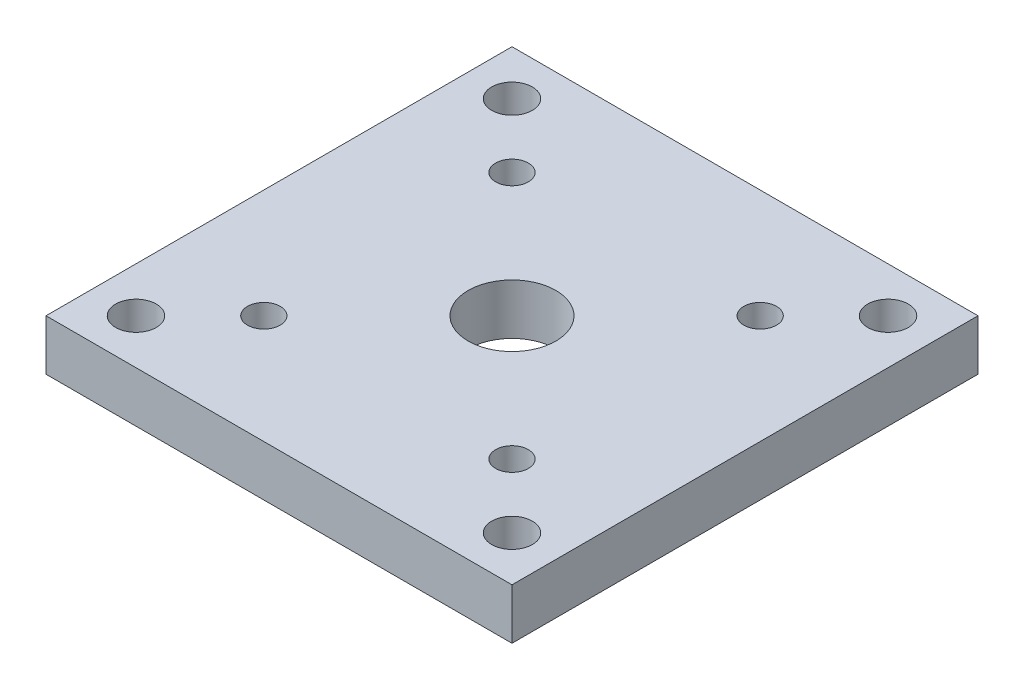
from build123d import *

# Parameters (mm, degrees)
SKETCH1_W           = 58.42
SKETCH1_H           = 58.42
SKETCH1_R           = 2.55
SKETCH1_R_2         = 5.5
SKETCH1_R_3         = 2.05
BOSS_EXTRUDE1_DEPTH = 6.35
CHAMFER1_SIZE       = 2.48


with BuildPart() as part:
    # Sketch1 → Boss-Extrude1 (new body)
    with BuildSketch(Plane(origin=(0, 0, 0), x_dir=(1, 0, 0), z_dir=(0, 1, 0))):
        with Locations((29.21, 29.21)):
            Rectangle(SKETCH1_W, SKETCH1_H)
        with Locations(Location((5.64, 52.78, 0), (0, 0, 270))):
            Circle(SKETCH1_R, mode=Mode.SUBTRACT)
        with Locations(Location((52.78, 52.78, 0), (0, 0, 270))):
            Circle(SKETCH1_R, mode=Mode.SUBTRACT)
        with Locations(Location((52.78, 5.64, 0), (0, 0, 270))):
            Circle(SKETCH1_R, mode=Mode.SUBTRACT)
        with Locations(Location((5.64, 5.64, 0), (0, 0, 270))):
            Circle(SKETCH1_R, mode=Mode.SUBTRACT)
        with Locations(Location((29.21, 29.21, 0), (0, 0, 270))):
            Circle(SKETCH1_R_2, mode=Mode.SUBTRACT)
        with Locations(Location((13.653650814, 44.766349186, 0), (0, 0, 270))):
            Circle(SKETCH1_R_3, mode=Mode.SUBTRACT)
        with Locations(Location((44.766349186, 44.766349186, 0), (0, 0, 270))):
            Circle(SKETCH1_R_3, mode=Mode.SUBTRACT)
        with Locations(Location((44.766349186, 13.653650814, 0), (0, 0, 270))):
            Circle(SKETCH1_R_3, mode=Mode.SUBTRACT)
        with Locations(Location((13.653650814, 13.653650814, 0), (0, 0, 270))):
            Circle(SKETCH1_R_3, mode=Mode.SUBTRACT)
    extrude(amount=BOSS_EXTRUDE1_DEPTH)

    # Chamfer1
    chamfer1_edges = [part.edges().sort_by_distance(p)[0] for p in [
        (13.653650814, 0, -46.816349186),
        (44.766349186, 0, -46.816349186),
        (44.766349186, 0, -15.703650814),
        (13.653650814, 0, -15.703650814),
    ]]
    chamfer(chamfer1_edges, length=CHAMFER1_SIZE)


solid = part.part
